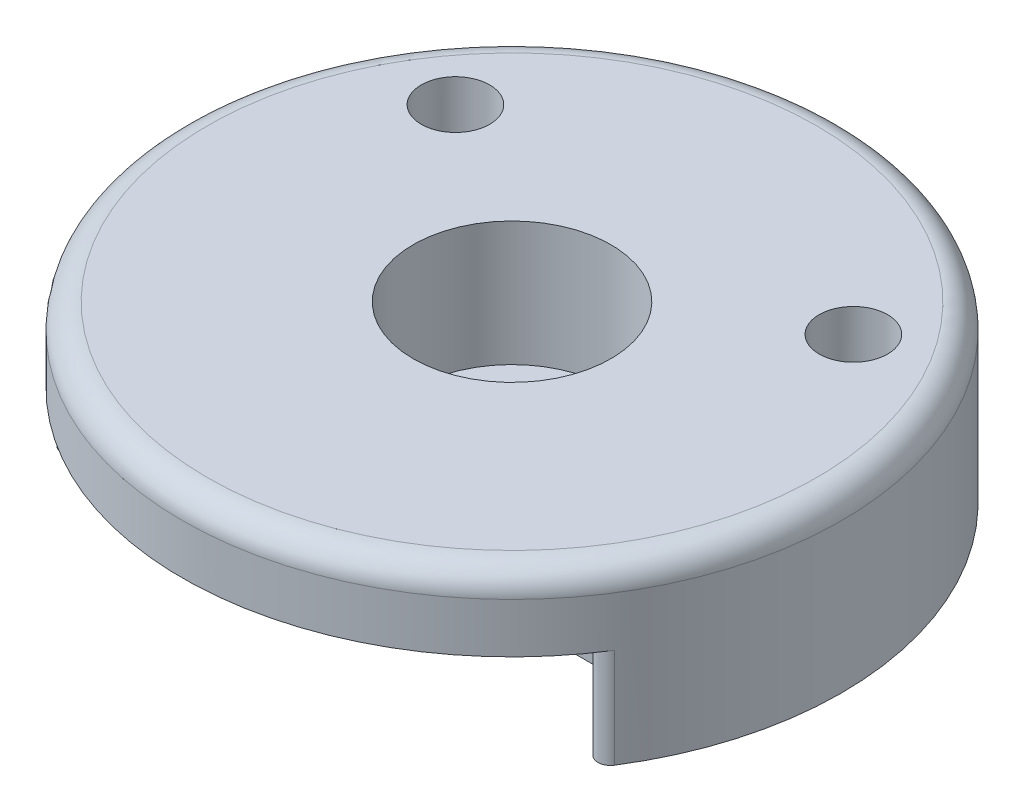
from build123d import *

# Parameters (mm, degrees)
SKETCH2_R               = 13.25
BOSS_EXTRUDE1_DEPTH     = 7
SKETCH3_R               = 3.975
CUT_EXTRUDE1_DEPTH      = 5
SKETCH4_W               = 20.55
SKETCH4_H               = 16.05
CUT_EXTRUDE2_DEPTH      = 1
SKETCH5_R               = 1.375
CUT_EXTRUDE3_DEPTH      = 6
FILLET1_R               = 1
CUT_EXTRUDE5_DEPTH      = 1
CUT_EXTRUDE5_DEPTH_BACK = 3
SKETCH6_W               = 20.55
SKETCH6_H               = 8.25
FILLET2_R               = 0.5


with BuildPart() as part:
    # Sketch2 → Boss-Extrude1 (new body)
    with BuildSketch(Plane(origin=(0, 0, 0), x_dir=(1, 0, 0), z_dir=(0, 1, 0))):
        with Locations(Location((0, 0, 0), (0, 0, 270))):
            Circle(SKETCH2_R)
    extrude(amount=BOSS_EXTRUDE1_DEPTH)

    # Sketch3 → Cut-Extrude1 (cut)
    with BuildSketch(Plane(origin=(0, 7, 0), x_dir=(1, 0, 0), z_dir=(0, 1, 0))):
        with Locations(Location((0, 0, 0), (0, 0, 270))):
            Circle(SKETCH3_R)
    extrude(amount=-CUT_EXTRUDE1_DEPTH, mode=Mode.SUBTRACT)

    # Sketch4 → Cut-Extrude2 (cut)
    with BuildSketch(Plane.XZ):
        Rectangle(SKETCH4_W, SKETCH4_H)
    extrude(amount=-CUT_EXTRUDE2_DEPTH, mode=Mode.SUBTRACT)

    # Sketch5 → Cut-Extrude3 (cut)
    with BuildSketch(Plane.XZ.offset(-1)):
        with Locations(Location((-8, -5.725, 0), (0, 0, 270))):
            Circle(SKETCH5_R)
        with Locations(Location((8, -5.725, 0), (0, 0, 270))):
            Circle(SKETCH5_R)
    extrude(amount=-CUT_EXTRUDE3_DEPTH, mode=Mode.SUBTRACT)

    # Fillet1
    fillet1_edges = [part.edges().sort_by_distance(p)[0] for p in [
        (0, 7, -13.25),
    ]]
    fillet(fillet1_edges, radius=FILLET1_R)

    # Sketch6 → Cut-Extrude5 (cut, two sides: drawn at the far end of the back side and taken through both)
    with BuildSketch(Plane.XZ.offset(-1).offset(-CUT_EXTRUDE5_DEPTH_BACK)):
        with Locations((0, 9.125)):
            Rectangle(SKETCH6_W, SKETCH6_H)
    extrude(amount=CUT_EXTRUDE5_DEPTH + CUT_EXTRUDE5_DEPTH_BACK, mode=Mode.SUBTRACT)

    # Fillet2
    fillet2_edges = [part.edges().sort_by_distance(p)[0] for p in [
        (-10.275, 2, 8.36581586),
        (10.275, 2, 8.36581586),
    ]]
    fillet(fillet2_edges, radius=FILLET2_R)


solid = part.part
